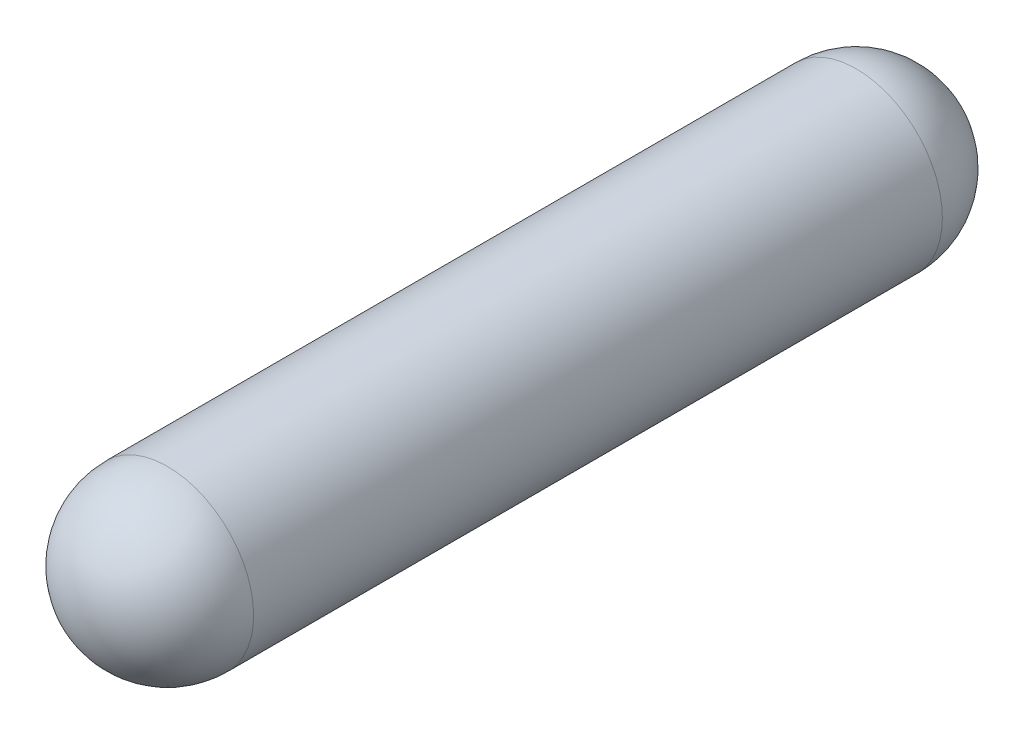
from build123d import *

# Parameters (mm, degrees)
BASES_R               = 0.3
BASE_DEPTH            = 1.2
FRONTDOME_FACE_RADIUS = 0.3
FRONTDOME_HEIGHT      = 0.3
REARDOME_FACE_RADIUS  = 0.3
REARDOME_HEIGHT       = 0.3


with BuildPart() as part:
    # BaseS → Base (new, symmetric)
    with BuildSketch(Plane.XY):
        Circle(BASES_R)
    extrude(amount=BASE_DEPTH, both=True)

    # FrontDome: a dome of height H over a round flat face of radius A is a cap of a sphere of radius (A * A + H * H) / (2 * H)
    frontdome_r = (FRONTDOME_FACE_RADIUS * FRONTDOME_FACE_RADIUS + FRONTDOME_HEIGHT * FRONTDOME_HEIGHT) / (2 * FRONTDOME_HEIGHT)
    frontdome_base = Plane((0, 0, 1.2), z_dir=(0, 0, 1))
    with Locations(frontdome_base.offset(FRONTDOME_HEIGHT - frontdome_r)):
        frontdome_ball = Sphere(frontdome_r, mode=Mode.PRIVATE)
    add(split(frontdome_ball, bisect_by=frontdome_base, keep=Keep.TOP, mode=Mode.PRIVATE))

    # RearDome: a dome of height H over a round flat face of radius A is a cap of a sphere of radius (A * A + H * H) / (2 * H)
    reardome_r = (REARDOME_FACE_RADIUS * REARDOME_FACE_RADIUS + REARDOME_HEIGHT * REARDOME_HEIGHT) / (2 * REARDOME_HEIGHT)
    reardome_base = Plane((0, 0, -1.2), z_dir=(0, 0, -1))
    with Locations(reardome_base.offset(REARDOME_HEIGHT - reardome_r)):
        reardome_ball = Sphere(reardome_r, mode=Mode.PRIVATE)
    add(split(reardome_ball, bisect_by=reardome_base, keep=Keep.TOP, mode=Mode.PRIVATE))


solid = part.part
